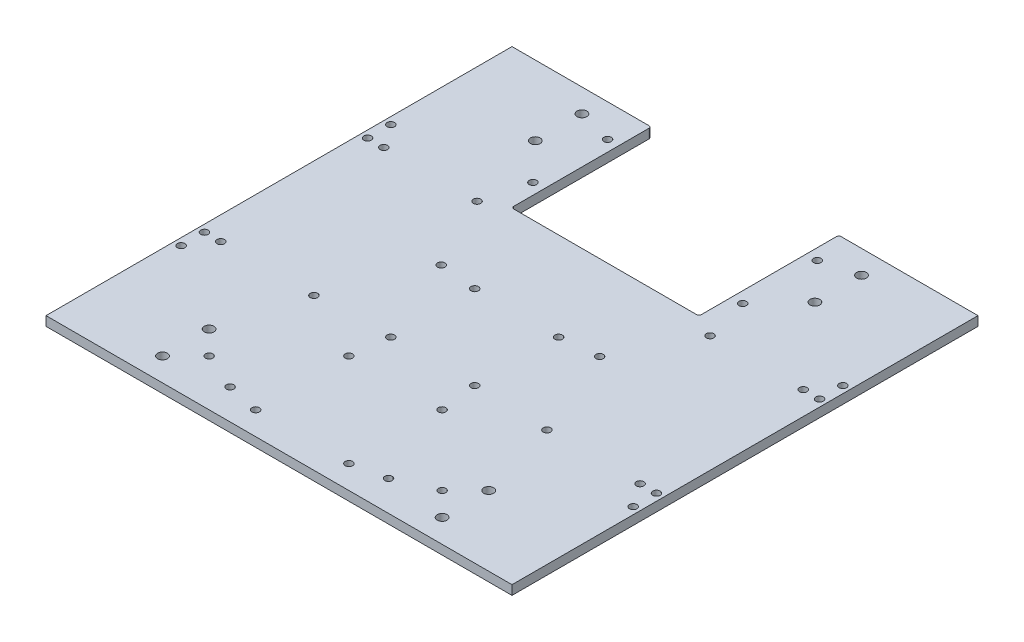
from build123d import *

# Parameters (mm, degrees)
SKETCH_1_W          = 200
SKETCH_1_H          = 200
SKETCH_1_R          = 1.6
SKETCH_1_R_2        = 2.1
EXTRUDE_1_DEPTH     = 4
CUT_EXTRUDE_1_REACH = 143.478
SKETCH_2_R          = 1.6
SKETCH_2_W          = 80.5
SKETCH_2_H          = 60
CUT_EXTRUDE_START   = -4
SKETCH_3_R          = 1.6
CUT_EXTRUDE_2_DEPTH = 4
FILLET_1_R          = 1


with BuildPart() as part:
    # 草图1 → 凸台-拉伸1 (new body)
    with BuildSketch(Plane(origin=(0, 0, 0), x_dir=(1, 0, 0), z_dir=(0, 1, 0))):
        Rectangle(SKETCH_1_W, SKETCH_1_H)
        with Locations(Location((-97, 35, 0), (0, 0, 270))):
            Circle(SKETCH_1_R, mode=Mode.SUBTRACT)
        with Locations(Location((-97, 45, 0), (0, 0, 270))):
            Circle(SKETCH_1_R, mode=Mode.SUBTRACT)
        with Locations(Location((-97, -45, 0), (0, 0, 90))):
            Circle(SKETCH_1_R, mode=Mode.SUBTRACT)
        with Locations(Location((-97, -35, 0), (0, 0, 90))):
            Circle(SKETCH_1_R, mode=Mode.SUBTRACT)
        with Locations(Location((97, -45, 0), (0, 0, 270))):
            Circle(SKETCH_1_R, mode=Mode.SUBTRACT)
        with Locations(Location((97, -35, 0), (0, 0, 270))):
            Circle(SKETCH_1_R, mode=Mode.SUBTRACT)
        with Locations(Location((97, 35, 0), (0, 0, 90))):
            Circle(SKETCH_1_R, mode=Mode.SUBTRACT)
        with Locations(Location((97, 45, 0), (0, 0, 90))):
            Circle(SKETCH_1_R, mode=Mode.SUBTRACT)
        with Locations(Location((-18, -34, 0), (0, 0, 270))):
            Circle(SKETCH_1_R, mode=Mode.SUBTRACT)
        with Locations(Location((18, -34, 0), (0, 0, 270))):
            Circle(SKETCH_1_R, mode=Mode.SUBTRACT)
        with Locations(Location((18, 2, 0), (0, 0, 270))):
            Circle(SKETCH_1_R, mode=Mode.SUBTRACT)
        with Locations(Location((-18, 2, 0), (0, 0, 270))):
            Circle(SKETCH_1_R, mode=Mode.SUBTRACT)
        with Locations(Location((-34, -87, 0), (0, 0, 270))):
            Circle(SKETCH_1_R, mode=Mode.SUBTRACT)
        with Locations(Location((34, -87, 0), (0, 0, 270))):
            Circle(SKETCH_1_R, mode=Mode.SUBTRACT)
        with Locations(Location((34, 3.6, 0), (0, 0, 270))):
            Circle(SKETCH_1_R, mode=Mode.SUBTRACT)
        with Locations(Location((-34, 3.6, 0), (0, 0, 270))):
            Circle(SKETCH_1_R, mode=Mode.SUBTRACT)
        with Locations(Location((-60, 90, 0), (0, 0, 270))):
            Circle(SKETCH_1_R_2, mode=Mode.SUBTRACT)
        with Locations(Location((-60, 70, 0), (0, 0, 270))):
            Circle(SKETCH_1_R_2, mode=Mode.SUBTRACT)
        with Locations(Location((60, 70, 0), (0, 0, 90))):
            Circle(SKETCH_1_R_2, mode=Mode.SUBTRACT)
        with Locations(Location((60, 90, 0), (0, 0, 90))):
            Circle(SKETCH_1_R_2, mode=Mode.SUBTRACT)
        with Locations(Location((60, -70, 0), (0, 0, 270))):
            Circle(SKETCH_1_R_2, mode=Mode.SUBTRACT)
        with Locations(Location((60, -90, 0), (0, 0, 270))):
            Circle(SKETCH_1_R_2, mode=Mode.SUBTRACT)
        with Locations(Location((-60, -70, 0), (0, 0, 90))):
            Circle(SKETCH_1_R_2, mode=Mode.SUBTRACT)
        with Locations(Location((-60, -90, 0), (0, 0, 90))):
            Circle(SKETCH_1_R_2, mode=Mode.SUBTRACT)
        with Locations(Location((-90, 35, 0), (0, 0, 270))):
            Circle(SKETCH_1_R, mode=Mode.SUBTRACT)
        with Locations(Location((-50, 35, 0), (0, 0, 270))):
            Circle(SKETCH_1_R, mode=Mode.SUBTRACT)
        with Locations(Location((-50, -35, 0), (0, 0, 270))):
            Circle(SKETCH_1_R, mode=Mode.SUBTRACT)
        with Locations(Location((-90, -35, 0), (0, 0, 270))):
            Circle(SKETCH_1_R, mode=Mode.SUBTRACT)
        with Locations(Location((90, 35, 0), (0, 0, 90))):
            Circle(SKETCH_1_R, mode=Mode.SUBTRACT)
        with Locations(Location((50, 35, 0), (0, 0, 90))):
            Circle(SKETCH_1_R, mode=Mode.SUBTRACT)
        with Locations(Location((50, -35, 0), (0, 0, 90))):
            Circle(SKETCH_1_R, mode=Mode.SUBTRACT)
        with Locations(Location((90, -35, 0), (0, 0, 90))):
            Circle(SKETCH_1_R, mode=Mode.SUBTRACT)
        with Locations(Location((-20, -50, 0), (0, 0, 270))):
            Circle(SKETCH_1_R, mode=Mode.SUBTRACT)
        with Locations(Location((20, -50, 0), (0, 0, 270))):
            Circle(SKETCH_1_R, mode=Mode.SUBTRACT)
        with Locations(Location((20, -90, 0), (0, 0, 270))):
            Circle(SKETCH_1_R, mode=Mode.SUBTRACT)
        with Locations(Location((-20, -90, 0), (0, 0, 270))):
            Circle(SKETCH_1_R, mode=Mode.SUBTRACT)
    extrude(amount=EXTRUDE_1_DEPTH)

    # 草图2 → 切除-拉伸1 (cut, up to next)
    with BuildSketch(Plane(origin=(0, 4, 0), x_dir=(1, 0, 0), z_dir=(0, 1, 0)), mode=Mode.PRIVATE) as cut_extrude_1_sk1:
        with Locations(Location((45, 86, 0), (0, 0, 270))):
            Circle(SKETCH_2_R)
    cut_extrude_1_tool1 = extrude(cut_extrude_1_sk1.sketch, amount=-CUT_EXTRUDE_1_REACH, mode=Mode.PRIVATE) & part.part
    # 草图2 → 切除-拉伸1 (cut, up to next)
    with BuildSketch(Plane(origin=(0, 4, 0), x_dir=(1, 0, 0), z_dir=(0, 1, 0)), mode=Mode.PRIVATE) as cut_extrude_1_sk2:
        with Locations(Location((45, 54, 0), (0, 0, 90))):
            Circle(SKETCH_2_R)
    cut_extrude_1_tool2 = extrude(cut_extrude_1_sk2.sketch, amount=-CUT_EXTRUDE_1_REACH, mode=Mode.PRIVATE) & part.part
    # 草图2 → 切除-拉伸1 (cut, up to next)
    with BuildSketch(Plane(origin=(0, 4, 0), x_dir=(1, 0, 0), z_dir=(0, 1, 0)), mode=Mode.PRIVATE) as cut_extrude_1_sk3:
        with Locations(Location((-45, 54, 0), (0, 0, 270))):
            Circle(SKETCH_2_R)
    cut_extrude_1_tool3 = extrude(cut_extrude_1_sk3.sketch, amount=-CUT_EXTRUDE_1_REACH, mode=Mode.PRIVATE) & part.part
    # 草图2 → 切除-拉伸1 (cut, up to next)
    with BuildSketch(Plane(origin=(0, 4, 0), x_dir=(1, 0, 0), z_dir=(0, 1, 0)), mode=Mode.PRIVATE) as cut_extrude_1_sk4:
        with Locations(Location((-45, 86, 0), (0, 0, 90))):
            Circle(SKETCH_2_R)
    cut_extrude_1_tool4 = extrude(cut_extrude_1_sk4.sketch, amount=-CUT_EXTRUDE_1_REACH, mode=Mode.PRIVATE) & part.part
    # 草图2 → 切除-拉伸1 (cut, up to next)
    with BuildSketch(Plane(origin=(0, 4, 0), x_dir=(1, 0, 0), z_dir=(0, 1, 0)), mode=Mode.PRIVATE) as cut_extrude_1_sk5:
        with Locations((0, 70)):
            Rectangle(SKETCH_2_W, SKETCH_2_H)
    cut_extrude_1_tool5 = extrude(cut_extrude_1_sk5.sketch, amount=-CUT_EXTRUDE_1_REACH, mode=Mode.PRIVATE) & part.part
    add(cut_extrude_1_tool1.solids().sort_by_distance((45, 4, -86))[0], mode=Mode.SUBTRACT)
    add(cut_extrude_1_tool2.solids().sort_by_distance((45, 4, -54))[0], mode=Mode.SUBTRACT)
    add(cut_extrude_1_tool3.solids().sort_by_distance((-45, 4, -54))[0], mode=Mode.SUBTRACT)
    add(cut_extrude_1_tool4.solids().sort_by_distance((-45, 4, -86))[0], mode=Mode.SUBTRACT)
    add(cut_extrude_1_tool5.solids().sort_by_distance((0, 4, -70))[0], mode=Mode.SUBTRACT)

    # 草图3 → 切除-拉伸2 (cut)
    with BuildSketch(Plane(origin=(0, 4, 0), x_dir=(1, 0, 0), z_dir=(0, 1, 0)).offset(CUT_EXTRUDE_START)):
        with Locations(Location((-50, -80, 0), (0, 0, 270))):
            Circle(SKETCH_3_R)
        with Locations(Location((50, -80, 0), (0, 0, 270))):
            Circle(SKETCH_3_R)
        with Locations(Location((50, 35, 0), (0, 0, 90))):
            Circle(SKETCH_3_R)
        with Locations(Location((-50, 35, 0), (0, 0, 270))):
            Circle(SKETCH_3_R)
    extrude(amount=CUT_EXTRUDE_2_DEPTH, mode=Mode.SUBTRACT)

    # 圆角1
    fillet_1_edges = [part.edges().sort_by_distance(p)[0] for p in [
        (40.25, 2, -100),
        (40.25, 2, -40),
        (-40.25, 2, -40),
        (-40.25, 2, -100),
    ]]
    fillet(fillet_1_edges, radius=FILLET_1_R)


solid = part.part
